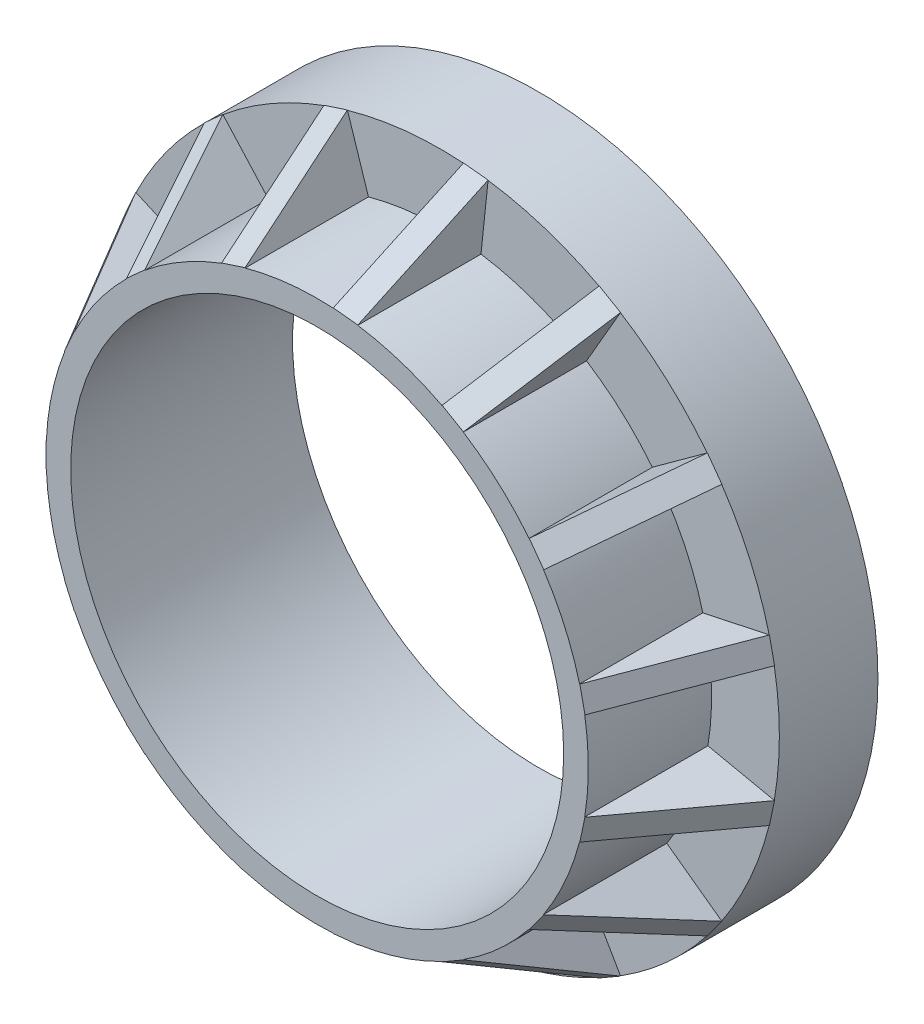
from build123d import *

# Parameters (mm, degrees)
SKETCH1_R           = 27.5
SKETCH1_R_2         = 20
BOSS_EXTRUDE1_DEPTH = 8
SKETCH2_R           = 22
SKETCH2_R_2         = 20
BOSS_EXTRUDE2_DEPTH = 10
BOSS_EXTRUDE3_DEPTH = 1
CIRPATTERN1_COUNT   = 15


with BuildPart() as part:
    # Sketch1 → Boss-Extrude1 (new body)
    with BuildSketch(Plane.XY):
        Circle(SKETCH1_R)
        Circle(SKETCH1_R_2, mode=Mode.SUBTRACT)
    extrude(amount=BOSS_EXTRUDE1_DEPTH)

    # Sketch2 → Boss-Extrude2 (add)
    with BuildSketch(Plane.XY.offset(8)):
        Circle(SKETCH2_R)
        Circle(SKETCH2_R_2, mode=Mode.SUBTRACT)
    extrude(amount=BOSS_EXTRUDE2_DEPTH)

    # Sketch3 → Boss-Extrude3 (add, symmetric)
    with BuildSketch(Plane(origin=(0, 0, 0), x_dir=(1, 0, 0), z_dir=(0, 1, 0))):
        Polygon((-22, -18), (-27.5, -8), (-22, -8), (-20.5, -8), (-20.5, -18), align=None)
    boss_extrude3 = extrude(amount=BOSS_EXTRUDE3_DEPTH, both=True)

    # CirPattern1: Boss-Extrude3 ×15 about axis
    cirpattern1_axis = Axis((0, 0, 0), (0, 0, 1))
    for i in range(1, CIRPATTERN1_COUNT):
        add(boss_extrude3.rotate(cirpattern1_axis, i * 360 / CIRPATTERN1_COUNT))


solid = part.part
